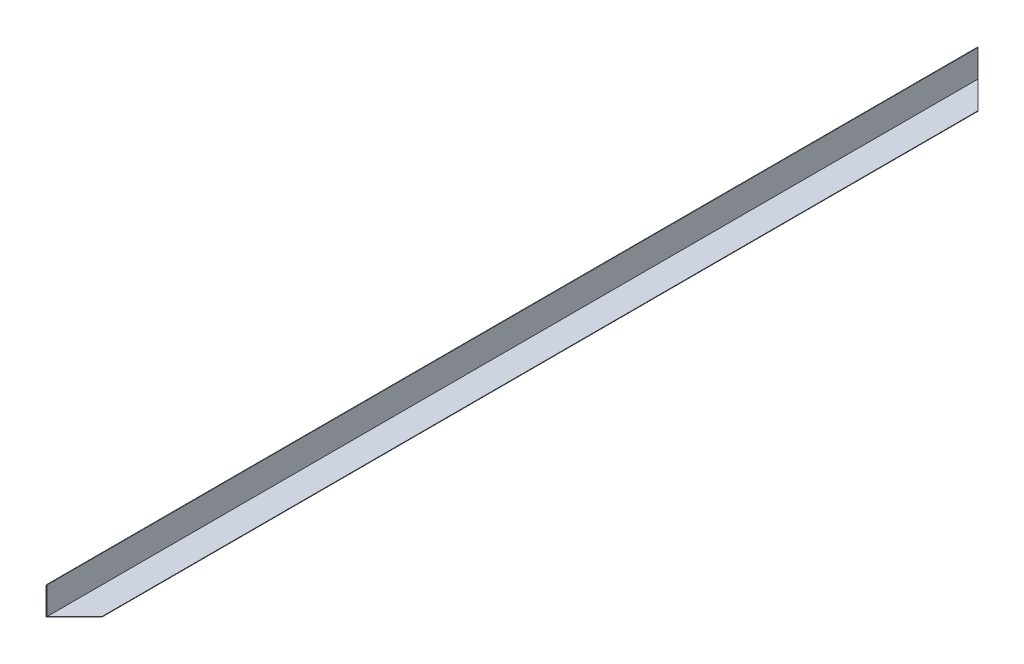
from build123d import *

# Parameters (mm, degrees)
BOSS_EXTRUDE1_DEPTH = 755


with BuildPart() as part:
    # Sketch1 → Boss-Extrude1 (new, symmetric)
    with BuildSketch(Plane.XY):
        Polygon((0, 45), (0, 0), (45, 0), (45, 0.833333333), (0.833333333, 0.833333333), (0.833333333, 45), align=None)
    extrude(amount=BOSS_EXTRUDE1_DEPTH, both=True)

    # SurfaceCut1
    split(bisect_by=Plane(origin=(375.416666667, 0, -375.416666667), x_dir=(0.7071067811865482, 0, 0.7071067811865468), z_dir=(-0.7071067811865468, 0, 0.7071067811865482)), keep=Keep.TOP)

    # SurfaceCut2
    split(bisect_by=Plane(origin=(375.416666667, 0, 375.416666667), x_dir=(0.7071067811865482, 0, -0.7071067811865468), z_dir=(0.7071067811865468, 0, 0.7071067811865482)), keep=Keep.BOTTOM)


solid = part.part
